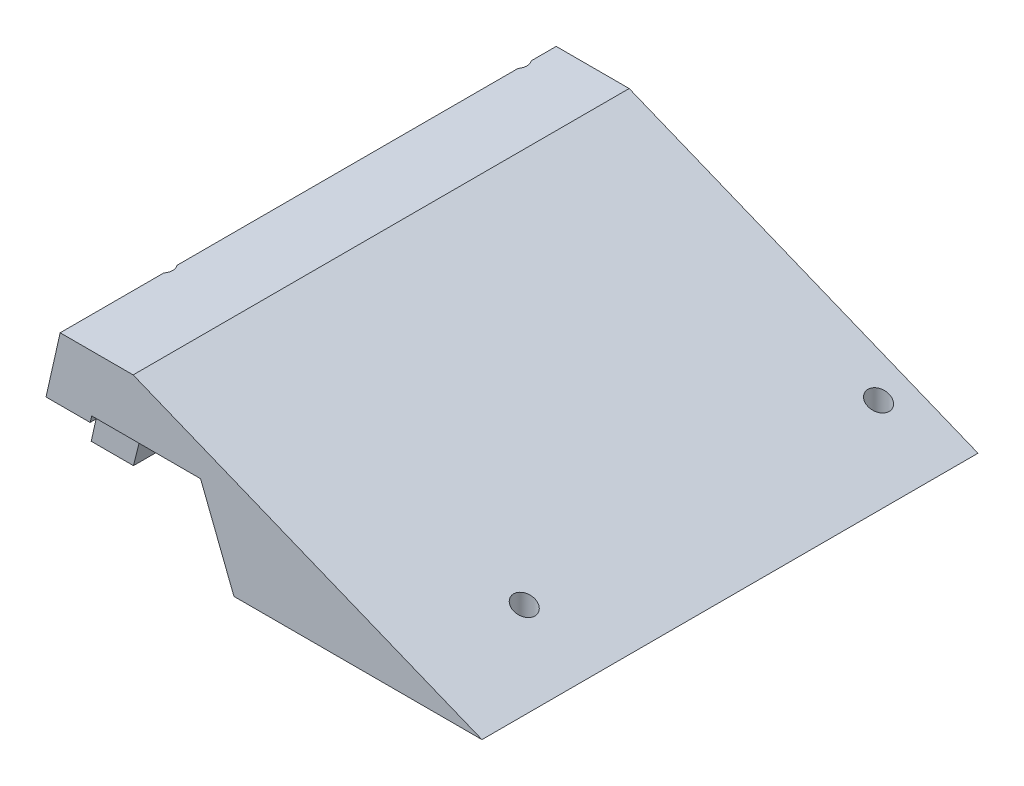
from build123d import *

# Parameters (mm, degrees)
EXTRUDE_1_DEPTH     = 63
EXTRUDE_2_DEPTH     = 6
SKETCH_3_W          = 8
SKETCH_3_H          = 10
CUT_EXTRUDE_1_DEPTH = 17
SKETCH_4_R          = 1.35
CUT_EXTRUDE_2_DEPTH = 34


with BuildPart() as part:
    # 草图1 → 凸台-拉伸1 (new body)
    with BuildSketch(Plane.XY):
        Polygon((5.368916437, 0), (10.737832874, 0), (13.433272115, 10.825245017), (27.262006405, 10.825245017), (31.5, 0), (63, 0), (18.696157585, 17.96451652), (9.426538108, 17.96451652), align=None)
    extrude(amount=EXTRUDE_1_DEPTH)

    # 草图2 → 凸台-拉伸2 (add)
    with BuildSketch(Plane(origin=(0, 0, 0), x_dir=(-1, 0, 0), z_dir=(0, 0, -1))):
        Polygon((-31.5, 0), (-27.262006405, 10.825245017), (-13.433272115, 10.825245017), (-10.737832874, 0), align=None)
    extrude(amount=-EXTRUDE_2_DEPTH)

    # 草图3 → 切除-拉伸1 (cut)
    with BuildSketch(Plane(origin=(0, 0, 0), x_dir=(0, 0, -1), z_dir=(1, 0, 0))):
        with Locations((-59, 5)):
            Rectangle(SKETCH_3_W, SKETCH_3_H)
    extrude(amount=CUT_EXTRUDE_1_DEPTH, mode=Mode.SUBTRACT)

    # 草图4 → 切除-拉伸2 (cut)
    with BuildSketch(Plane.XZ):
        with Locations(Location((8.368916437, 49, 0), (0, 0, 270))):
            Circle(SKETCH_4_R)
        with Locations(Location((54.368916437, 49, 0), (0, 0, 270))):
            Circle(SKETCH_4_R)
        with Locations(Location((54.368916437, 4, 0), (0, 0, 270))):
            Circle(SKETCH_4_R)
        with Locations(Location((8.368916437, 4, 0), (0, 0, 270))):
            Circle(SKETCH_4_R)
    extrude(amount=-CUT_EXTRUDE_2_DEPTH, mode=Mode.SUBTRACT)


solid = part.part
